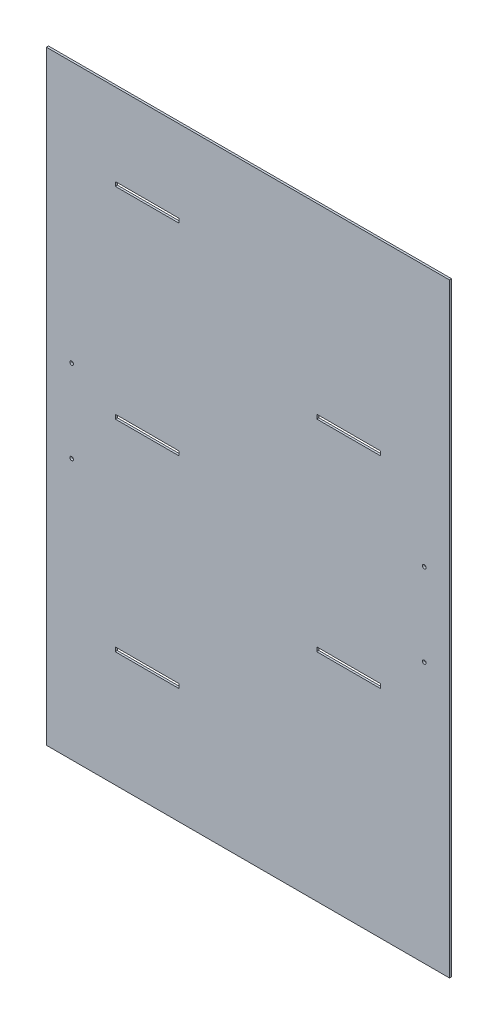
from build123d import *

# Parameters (mm, degrees)
SKETCH1_W            = 609.6
SKETCH1_H            = 914.4
BOSS_EXTRUDE1_DEPTH  = 1.5875
SKETCH2_W            = 96.52
SKETCH2_H            = 6.35
CUT_EXTRUDE1_DEPTH   = 550.495187081
M5_CLEARANCE_HOLE1_D = 5.5


with BuildPart() as part:
    # Sketch1 → Boss-Extrude1 (new, symmetric)
    with BuildSketch(Plane.XY):
        Rectangle(SKETCH1_W, SKETCH1_H)
    extrude(amount=BOSS_EXTRUDE1_DEPTH, both=True)

    # Sketch2 → Cut-Extrude1 (cut, through all)
    with BuildSketch(Plane.XY.offset(1.5875)):
        with Locations((152.4, 177.8)):
            Rectangle(SKETCH2_W, SKETCH2_H)
        with Locations((-152.4, 25.4)):
            Rectangle(SKETCH2_W, SKETCH2_H)
        with Locations((152.4, -127)):
            Rectangle(SKETCH2_W, SKETCH2_H)
        with Locations((-152.4, -279.4)):
            Rectangle(SKETCH2_W, SKETCH2_H)
        with Locations((-152.4, 330.2)):
            Rectangle(SKETCH2_W, SKETCH2_H)
    extrude(amount=-CUT_EXTRUDE1_DEPTH, mode=Mode.SUBTRACT)

    # M5 Clearance Hole1 (through all)
    with Locations(Plane.XY.offset(1.5875)):
        with Locations((-266.7, 62.5), (-266.7, -62.5), (266.7, 62.5), (266.7, -62.5)):
            Hole(M5_CLEARANCE_HOLE1_D / 2)


solid = part.part
